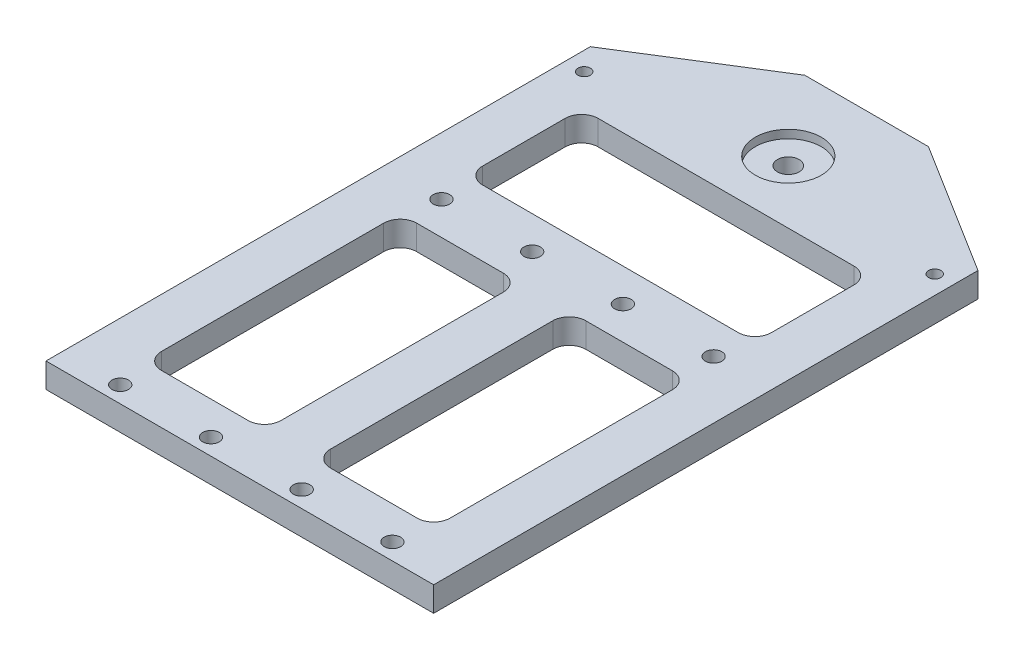
from build123d import *

# Parameters (mm, degrees)
SKETCH1_W                    = 298.45
SKETCH1_H                    = 482.6
BOSS_EXTRUDE1_DEPTH          = 19.05
F_1_2_0_5_DIAMETER_HOLE1_D   = 12.7
LPATTERN1_COUNT              = 4
LPATTERN1_PITCH              = 69.85
LPATTERN1_COUNT_DIR2         = 2
LPATTERN1_PITCH_DIR2         = 247.2944
F_3_8_0_375_DIAMETER_HOLE1_D = 9.525
SKETCH6_R                    = 25.4
CUT_EXTRUDE1_DEPTH           = 6.35
F_3_4_10_TAPPED_HOLE1_D      = 16.66748
SKETCH10_W                   = 92.075
SKETCH10_H                   = 196.4944
SKETCH10_H_2                 = 76.5556
CUT_EXTRUDE2_DEPTH           = 568.74824086
FILLET1_R                    = 12.7
CUT_EXTRUDE3_DEPTH           = 568.74824086
CUT_EXTRUDE4_DEPTH           = 568.74824086


with BuildPart() as part:
    # Sketch1 → Boss-Extrude1 (new body)
    with BuildSketch(Plane(origin=(0, 0, 0), x_dir=(1, 0, 0), z_dir=(0, 1, 0))):
        with Locations((149.225, 241.3)):
            Rectangle(SKETCH1_W, SKETCH1_H)
    extrude(amount=BOSS_EXTRUDE1_DEPTH)

    # 1/2 (0.5) Diameter Hole1 (through all)
    with Locations(Plane(origin=(0, 19.05, 0), x_dir=(1, 0, 0), z_dir=(0, 1, 0))):
        with Locations((44.45, 12.7)):
            f_1_2_0_5_diameter_hole1 = Hole(F_1_2_0_5_DIAMETER_HOLE1_D / 2)

    # LPattern1: 1_2 _0.5_ Diameter Hole1 4 × 2
    with Locations(*[(i * LPATTERN1_PITCH, 0, -j * LPATTERN1_PITCH_DIR2) for i in range(LPATTERN1_COUNT) for j in range(LPATTERN1_COUNT_DIR2) if (i, j) != (0, 0)]):
        add(f_1_2_0_5_diameter_hole1, mode=Mode.SUBTRACT)

    # 3/8 (0.375) Diameter Hole1 (through all)
    with Locations(Plane(origin=(0, 19.05, 0), x_dir=(1, 0, 0), z_dir=(0, 1, 0))):
        with Locations((284.1625, 400.05), (14.2875, 400.05)):
            Hole(F_3_8_0_375_DIAMETER_HOLE1_D / 2)

    # Sketch6 → Cut-Extrude1 (cut)
    with BuildSketch(Plane(origin=(0, 19.05, 0), x_dir=(1, 0, 0), z_dir=(0, 1, 0))):
        with Locations(Location((149.225, 422.275, 0), (0, 0, 270))):
            Circle(SKETCH6_R)
    extrude(amount=-CUT_EXTRUDE1_DEPTH, mode=Mode.SUBTRACT)

    # 3/4-10 Tapped Hole1 (through all)
    with Locations(Plane(origin=(0, 0, 0), x_dir=(-1, 0, 0), z_dir=(0, -1, 0))):
        with Locations((-149.225, 422.275)):
            Hole(F_3_4_10_TAPPED_HOLE1_D / 2)

    # Sketch10 → Cut-Extrude2 (cut, through all)
    with BuildSketch(Plane(origin=(0, 19.05, 0), x_dir=(1, 0, 0), z_dir=(0, 1, 0))):
        with Locations((84.1375, 136.3472)):
            Rectangle(SKETCH10_W, SKETCH10_H)
        with Locations((214.3125, 136.3472)):
            Rectangle(SKETCH10_W, SKETCH10_H)
        with Locations((84.1375, 323.6722)):
            Rectangle(SKETCH10_W, SKETCH10_H_2)
        with Locations((214.3125, 323.6722)):
            Rectangle(SKETCH10_W, SKETCH10_H_2)
    extrude(amount=-CUT_EXTRUDE2_DEPTH, mode=Mode.SUBTRACT)

    # Fillet1
    fillet1_edges = [part.edges().sort_by_distance(p)[0] for p in [
        (38.1, 9.525, -38.1),
        (38.1, 9.525, -234.5944),
        (130.175, 9.525, -234.5944),
        (130.175, 9.525, -38.1),
        (168.275, 9.525, -38.1),
        (168.275, 9.525, -234.5944),
        (260.35, 9.525, -234.5944),
        (260.35, 9.525, -38.1),
        (38.1, 9.525, -285.3944),
        (38.1, 9.525, -361.95),
        (130.175, 9.525, -361.95),
        (130.175, 9.525, -285.3944),
        (168.275, 9.525, -285.3944),
        (168.275, 9.525, -361.95),
        (260.35, 9.525, -361.95),
        (260.35, 9.525, -285.3944),
    ]]
    fillet(fillet1_edges, radius=FILLET1_R)

    # Sketch11 → Cut-Extrude3 (cut, through all)
    with BuildSketch(Plane(origin=(0, 19.05, 0), x_dir=(1, 0, 0), z_dir=(0, 1, 0))):
        Polygon((0, 482.6), (0, 419.1), (101.6, 482.6), align=None)
        Polygon((298.45, 482.6), (196.85, 482.6), (298.45, 419.1), align=None)
    extrude(amount=-CUT_EXTRUDE3_DEPTH, mode=Mode.SUBTRACT)

    # Sketch12 → Cut-Extrude4 (cut, through all)
    with BuildSketch(Plane(origin=(0, 19.05, 0), x_dir=(1, 0, 0), z_dir=(0, 1, 0))):
        with BuildLine():
            Line((50.8, 285.3944), (247.65, 285.3944))
            ThreePointArc((247.65, 285.3944), (256.630256121, 289.114143879), (260.35, 298.0944))
            Line((260.35, 298.0944), (260.35, 361.5944))
            ThreePointArc((260.35, 361.5944), (256.630256121, 370.574656121), (247.65, 374.2944))
            Line((247.65, 374.2944), (50.8, 374.2944))
            ThreePointArc((50.8, 374.2944), (41.819743879, 370.574656121), (38.1, 361.5944))
            Line((38.1, 361.5944), (38.1, 298.0944))
            ThreePointArc((38.1, 298.0944), (41.819743879, 289.114143879), (50.8, 285.3944))
        make_face()
    extrude(amount=-CUT_EXTRUDE4_DEPTH, mode=Mode.SUBTRACT)


solid = part.part
